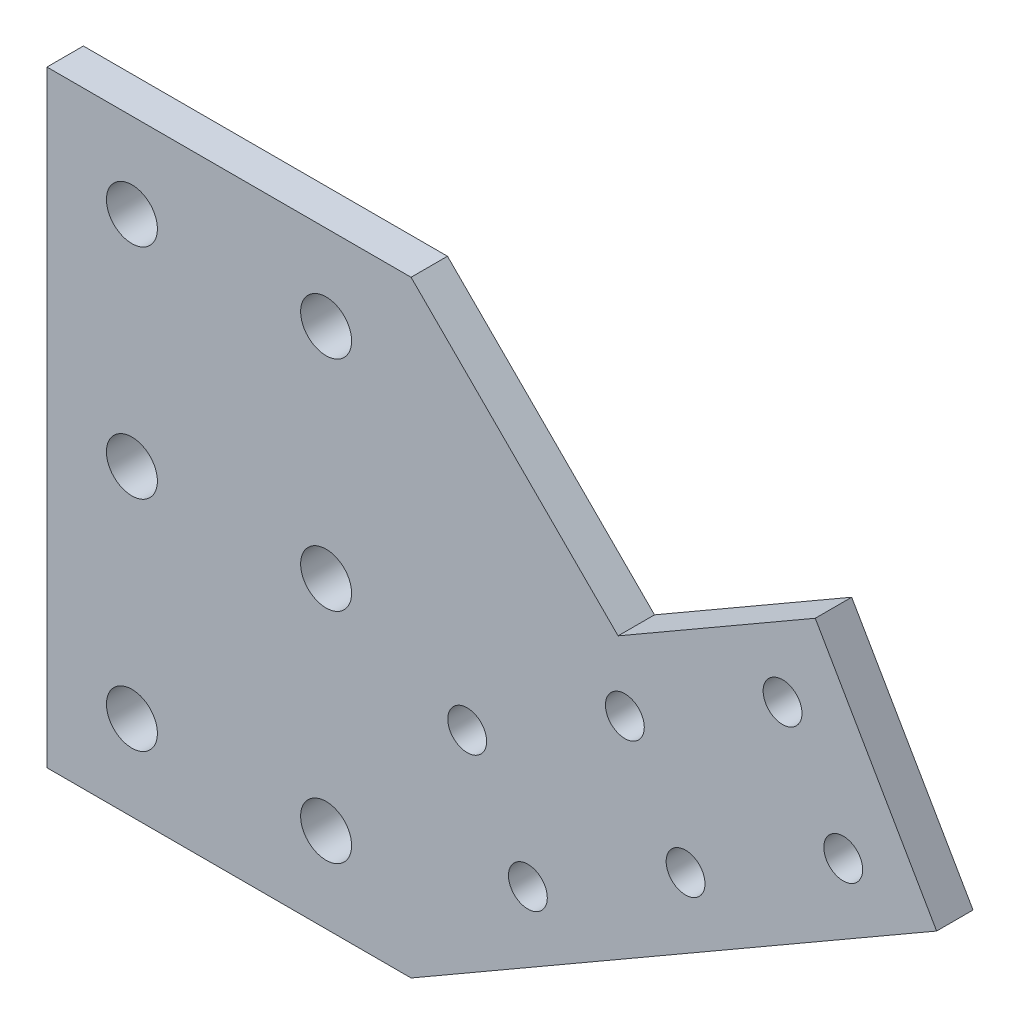
from build123d import *

# Parameters (mm, degrees)
EXTRUDE_1_DEPTH     = 3
SKETCH_2_R          = 2.1
SKETCH_2_R_2        = 1.6
CUT_EXTRUDE_1_DEPTH = 67.211781429


with BuildPart() as part:
    # 草图1 → 凸台-拉伸1 (new body)
    with BuildSketch(Plane.XY):
        Polygon((0, 0), (-30, 0), (-30, 50), (0, 50), (17.057713659, 32.942286341), (33.301270189, 42.320508076), (43.301270189, 25), align=None)
    extrude(amount=EXTRUDE_1_DEPTH)

    # 草图2 → 切除-拉伸1 (cut, through all)
    with BuildSketch(Plane.XY.offset(3)):
        with Locations((-23, 43)):
            Circle(SKETCH_2_R)
        with Locations((-7, 43)):
            Circle(SKETCH_2_R)
        with Locations((-23, 7)):
            Circle(SKETCH_2_R)
        with Locations((-7, 7)):
            Circle(SKETCH_2_R)
        with Locations((-23, 25)):
            Circle(SKETCH_2_R)
        with Locations((-7, 25)):
            Circle(SKETCH_2_R)
        with Locations((30.605117767, 34.990381057)):
            Circle(SKETCH_2_R_2)
        with Locations((35.605117767, 26.330127019)):
            Circle(SKETCH_2_R_2)
        with Locations((22.61473671, 18.830127019)):
            Circle(SKETCH_2_R_2)
        with Locations((17.61473671, 27.490381057)):
            Circle(SKETCH_2_R_2)
        with Locations((4.624355653, 19.990381057)):
            Circle(SKETCH_2_R_2)
        with Locations((9.624355653, 11.330127019)):
            Circle(SKETCH_2_R_2)
    extrude(amount=-CUT_EXTRUDE_1_DEPTH, mode=Mode.SUBTRACT)


solid = part.part
